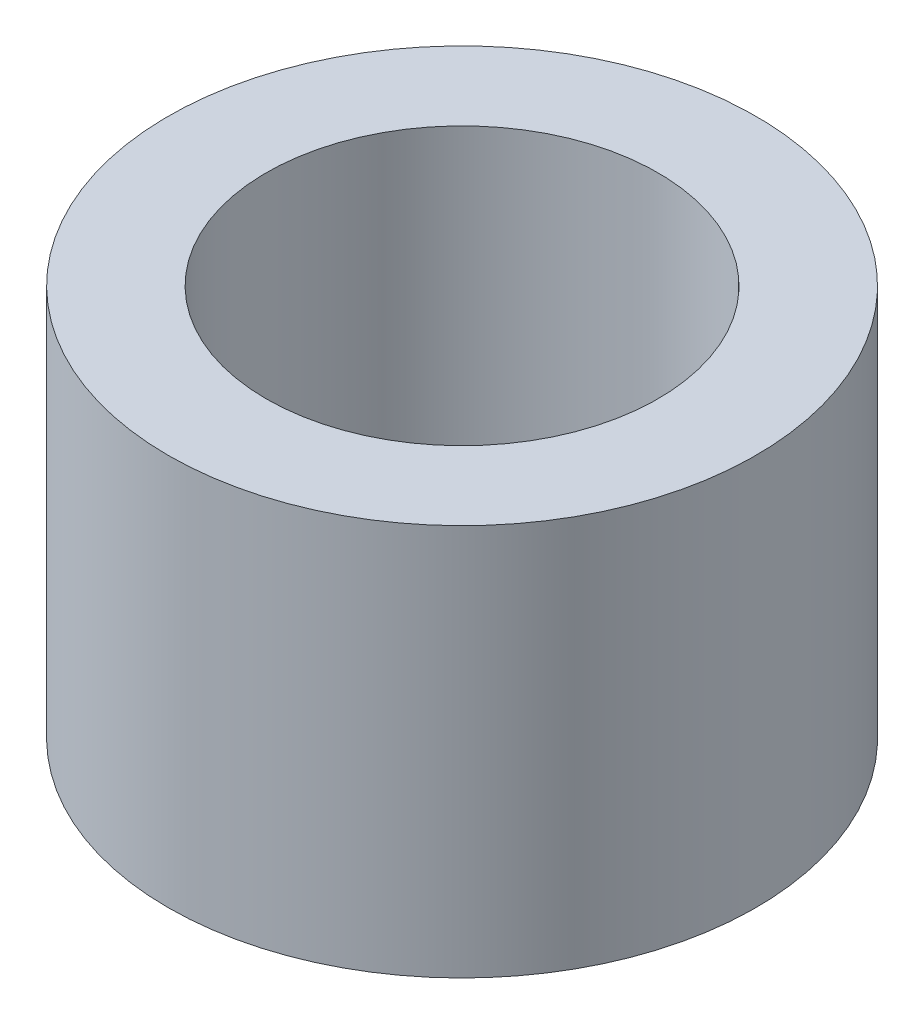
from build123d import *

# Parameters (mm, degrees)
SKETCH1_R           = 7.5
BOSS_EXTRUDE1_DEPTH = 10
SKETCH2_R           = 5
CUT_EXTRUDE1_DEPTH  = 10


with BuildPart() as part:
    # Sketch1 → Boss-Extrude1 (new body)
    with BuildSketch(Plane(origin=(0, 0, 0), x_dir=(1, 0, 0), z_dir=(0, 1, 0))):
        with Locations(Location((0, 0, 0), (0, 0, 270))):
            Circle(SKETCH1_R)
    extrude(amount=BOSS_EXTRUDE1_DEPTH)

    # Sketch2 → Cut-Extrude1 (cut)
    with BuildSketch(Plane(origin=(0, 10, 0), x_dir=(1, 0, 0), z_dir=(0, 1, 0))):
        with Locations(Location((0, 0, 0), (0, 0, 270))):
            Circle(SKETCH2_R)
    extrude(amount=-CUT_EXTRUDE1_DEPTH, mode=Mode.SUBTRACT)


solid = part.part
